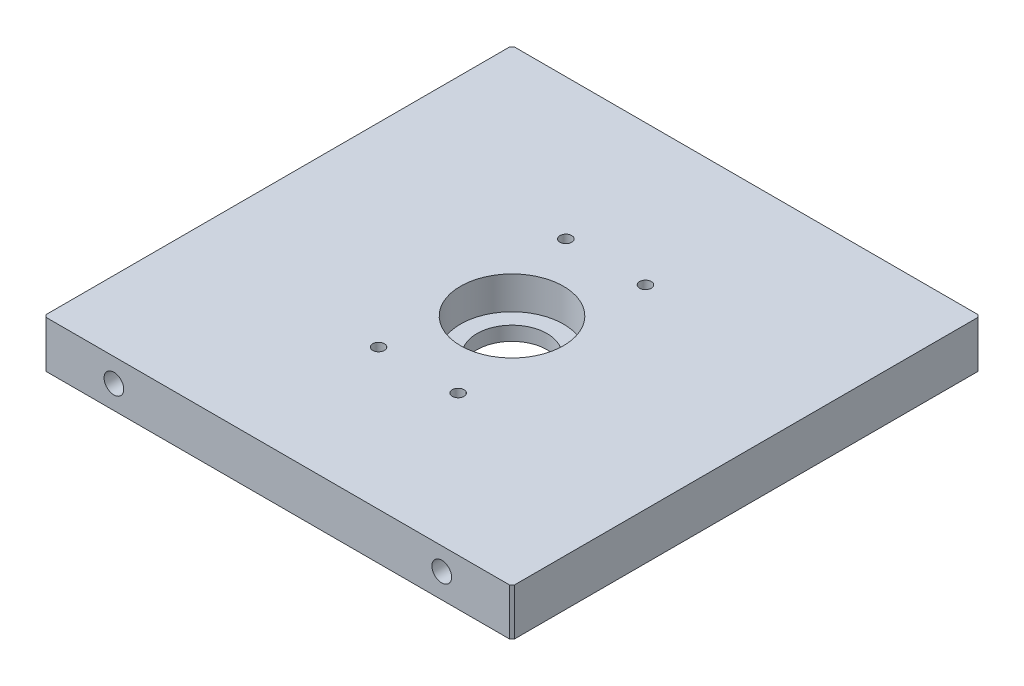
from build123d import *

# Parameters (mm, degrees)
BOSS_EXTRUDE1_DEPTH                  = 5
BOSS_EXTRUDE1_DEPTH_BACK             = 5
SKETCH1_W                            = 100
SKETCH1_H                            = 100
SKETCH1_R                            = 7.5
SKETCH2_R                            = 11
CUT_EXTRUDE1_DEPTH                   = 7
TAP_DRILL_FOR_M5X0_8_TAP1_AT_2_COUNT = 2
TAP_DRILL_FOR_M5X0_8_TAP1_AT_2_PITCH = 70.000402901
TAP_DRILL_FOR_M3X0_5_TAP2_D          = 2.5
TAP_DRILL_FOR_M3X0_5_TAP2_DEPTH      = 6
TAP_DRILL_FOR_M3X0_5_TAP2_TIP        = 0.751075774
CHAMFER1_SIZE                        = 0.5


with BuildPart() as part:
    # Sketch1 → Boss-Extrude1 (new, two sides: drawn at the far end of the back side and taken through both)
    with BuildSketch(Plane(origin=(0, 0, 0), x_dir=(1, 0, 0), z_dir=(0, 1, 0)).offset(-BOSS_EXTRUDE1_DEPTH_BACK)):
        Rectangle(SKETCH1_W, SKETCH1_H)
        with Locations(Location((0, 0, 0), (0, 0, 270))):
            Circle(SKETCH1_R, mode=Mode.SUBTRACT)
    extrude(amount=BOSS_EXTRUDE1_DEPTH + BOSS_EXTRUDE1_DEPTH_BACK)

    # Sketch2 → Cut-Extrude1 (cut)
    with BuildSketch(Plane(origin=(0, 5, 0), x_dir=(1, 0, 0), z_dir=(0, 1, 0))):
        with Locations(Location((0, 0, 0), (0, 0, 270))):
            Circle(SKETCH2_R)
    extrude(amount=-CUT_EXTRUDE1_DEPTH, mode=Mode.SUBTRACT)

    # Sketch6 → Tap Drill for M5x0.8 Tap1 (revolve, cut)
    with BuildSketch(Plane(origin=(-35, 0, 50), x_dir=(0, -1, 0), z_dir=(1, 0, 0))):
        Polygon((0, 0), (0, 11.2618073), (2.1, 10), (2.1, 0), align=None)
    tap_drill_for_m5x0_8_tap1 = revolve(axis=Axis((-35, 0, 56.35), (0, 0, -1)), mode=Mode.SUBTRACT)

    # Tap Drill for M5x0.8 Tap1 at 2: Tap Drill for M5x0.8 Tap1 ×2
    with Locations(*[Vector(0.9999942443098965, 0.0033928376146228614, 0) * (i * TAP_DRILL_FOR_M5X0_8_TAP1_AT_2_PITCH) for i in range(1, TAP_DRILL_FOR_M5X0_8_TAP1_AT_2_COUNT)]):
        add(tap_drill_for_m5x0_8_tap1, mode=Mode.SUBTRACT)

    # Mirror1: Tap Drill for M5x0.8 Tap1 across plane
    add(tap_drill_for_m5x0_8_tap1.mirror(Plane(origin=(0, 0, 0), x_dir=(1, 0, 0), z_dir=(0, 0, -1))), mode=Mode.SUBTRACT)

    # Mirror1 copy 1 sketch → Mirror1 copy 1 (revolve, cut)
    with BuildSketch(Plane(origin=(35, 0.2375, -50), x_dir=(0, -1, 0), z_dir=(1, 0, 0))):
        Polygon((0, 0), (0, -11.2618073), (2.1, -10), (2.1, 0), align=None)
    revolve(axis=Axis((35, 0.2375, -56.35), (0, 0, -1)), mode=Mode.SUBTRACT)

    # Tap Drill for M3x0.5 Tap2
    with Locations(Plane(origin=(0, 5, 0), x_dir=(1, 0, 0), z_dir=(0, 1, 0))):
        with Locations((-8.5, -20), (8.5, -20), (8.5, 20), (-8.5, 20)):
            Hole(TAP_DRILL_FOR_M3X0_5_TAP2_D / 2, depth=TAP_DRILL_FOR_M3X0_5_TAP2_DEPTH)
            with Locations((0, 0, -(TAP_DRILL_FOR_M3X0_5_TAP2_DEPTH + TAP_DRILL_FOR_M3X0_5_TAP2_TIP / 2))):  # 118° drill point
                Cone(0, TAP_DRILL_FOR_M3X0_5_TAP2_D / 2, TAP_DRILL_FOR_M3X0_5_TAP2_TIP, mode=Mode.SUBTRACT)

    # Chamfer1
    chamfer1_edges = [part.edges().sort_by_distance(p)[0] for p in [
        (-50, 0, -50),
        (50, 0, -50),
        (50, 0, 50),
        (-50, 0, 50),
    ]]
    chamfer(chamfer1_edges, length=CHAMFER1_SIZE)


solid = part.part
